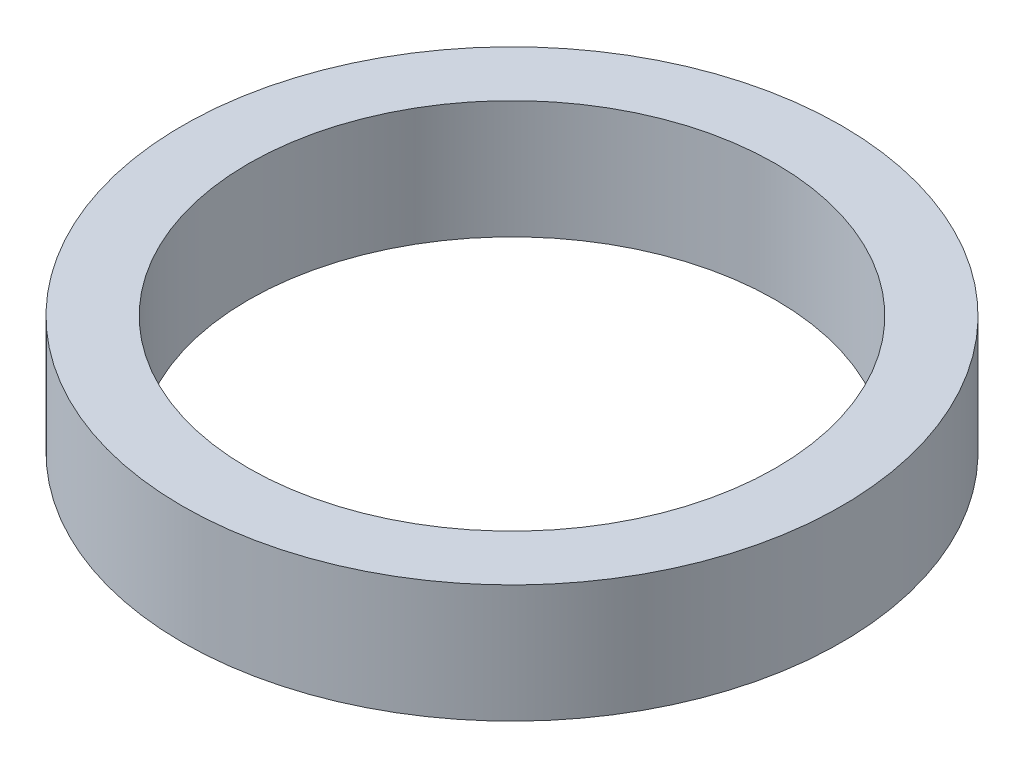
from build123d import *

# Parameters (mm, degrees)
SKETCH2_R           = 9.525
BOSS_EXTRUDE1_DEPTH = 3.41
SKETCH3_R           = 7.62
CUT_EXTRUDE1_DEPTH  = 14.895299565


with BuildPart() as part:
    # Sketch2 → Boss-Extrude1 (new body)
    with BuildSketch(Plane(origin=(0, 0, 0), x_dir=(1, 0, 0), z_dir=(0, 1, 0))):
        with Locations(Location((0, 0, 0), (0, 0, 270))):
            Circle(SKETCH2_R)
    extrude(amount=BOSS_EXTRUDE1_DEPTH)

    # Sketch3 → Cut-Extrude1 (cut, through all)
    with BuildSketch(Plane.XZ):
        with Locations(Location((0, 0, 0), (0, 0, 270))):
            Circle(SKETCH3_R)
    extrude(amount=-CUT_EXTRUDE1_DEPTH, mode=Mode.SUBTRACT)


solid = part.part
